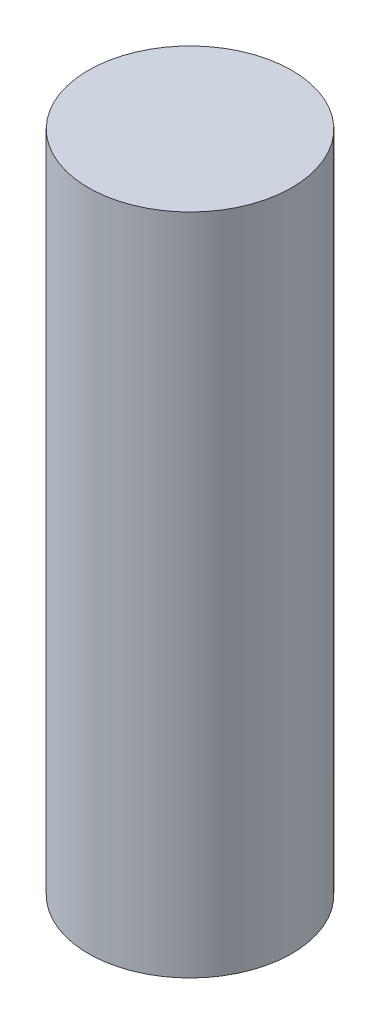
from build123d import *

# Parameters (mm, degrees)
SKETCH1_R           = 2.921
BOSS_EXTRUDE1_DEPTH = 19.05


with BuildPart() as part:
    # Sketch1 → Boss-Extrude1 (new body)
    with BuildSketch(Plane(origin=(0, 0, 0), x_dir=(1, 0, 0), z_dir=(0, 1, 0))):
        with Locations(Location((0, 0, 0), (0, 0, 90))):
            Circle(SKETCH1_R)
    extrude(amount=BOSS_EXTRUDE1_DEPTH)


solid = part.part
